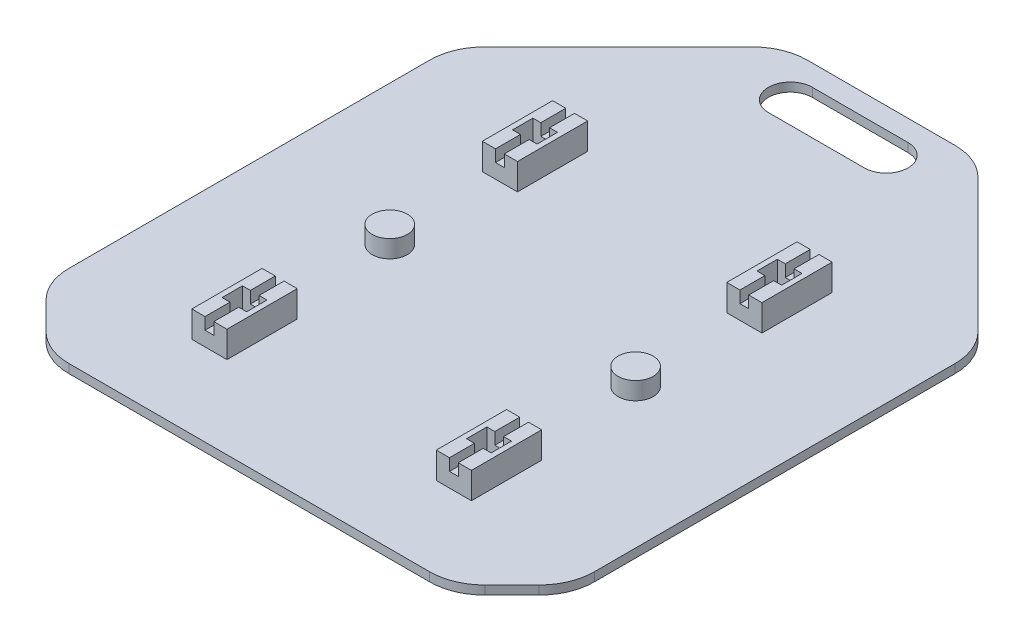
from build123d import *

# Parameters (mm, degrees)
BODY_DEPTH          = 6.35
HANDLE_DEPTH        = 6.35
FILLET1_R           = 40
FILLET2_R           = 40
SKETCH3_W           = 25.4
SKETCH3_H           = 50.8
BOSS_EXTRUDE2_DEPTH = 19.05
SKETCH4_W           = 17.78
SKETCH4_H           = 14.7447
CUT_EXTRUDE1_DEPTH  = 17.78
SKETCH5_W           = 6.35
SKETCH5_H           = 18.02765
CUT_EXTRUDE2_DEPTH  = 8.5725
SKETCH6_R           = 12.7
BOSS_EXTRUDE3_DEPTH = 12.7


with BuildPart() as part:
    # Sketch1 → Body (new body)
    with BuildSketch(Plane(origin=(0, 0, 0), x_dir=(1, 0, 0), z_dir=(0, 1, 0))):
        Polygon((0, 0), (294, 0), (336.996020767, 43.003978862), (336.996020767, 337.003978862), (217, 456.999999629), (77, 456.999999629), (-42.996020767, 337.003978862), (-42.996020767, 43.003978862), align=None)
    extrude(amount=BODY_DEPTH)

    # Sketch2 → Handle (cut)
    with BuildSketch(Plane(origin=(0, 6.35, 0), x_dir=(1, 0, 0), z_dir=(0, 1, 0))):
        with BuildLine():
            Line((112.35, 441.799999629), (181.65, 441.799999629))
            ThreePointArc((181.65, 441.799999629), (197.5, 425.949999629), (181.65, 410.099999629))
            Line((181.65, 410.099999629), (112.35, 410.099999629))
            ThreePointArc((112.35, 410.099999629), (96.5, 425.949999629), (112.35, 441.799999629))
        make_face()
    extrude(amount=-HANDLE_DEPTH, mode=Mode.SUBTRACT)

    # Fillet1
    fillet1_edges = [part.edges().sort_by_distance(p)[0] for p in [
        (77, 3.175, -456.999999629),
        (217, 3.175, -456.999999629),
    ]]
    fillet(fillet1_edges, radius=FILLET1_R)

    # Fillet2
    fillet2_edges = [part.edges().sort_by_distance(p)[0] for p in [
        (-42.996020767, 3.175, -43.003978862),
        (-42.996020767, 3.175, -337.003978862),
        (336.996020767, 3.175, -337.003978862),
        (336.996020767, 3.175, -43.003978862),
        (294, 3.175, 0),
        (0, 3.175, 0),
    ]]
    fillet(fillet2_edges, radius=FILLET2_R)

    # Sketch3 → Boss-Extrude2 (add)
    with BuildSketch(Plane(origin=(0, 6.35, 0), x_dir=(1, 0, 0), z_dir=(0, 1, 0))):
        with Locations((235.396020767, 295.035436367)):
            Rectangle(SKETCH3_W, SKETCH3_H)
        with Locations((58.603979233, 295.035436367)):
            Rectangle(SKETCH3_W, SKETCH3_H)
        with Locations((235.396020767, 84.970353145)):
            Rectangle(SKETCH3_W, SKETCH3_H)
        with Locations((58.603979233, 84.970353145)):
            Rectangle(SKETCH3_W, SKETCH3_H)
    extrude(amount=BOSS_EXTRUDE2_DEPTH)

    # Sketch4 → Cut-Extrude1 (cut)
    with BuildSketch(Plane(origin=(0, 25.4, 0), x_dir=(1, 0, 0), z_dir=(0, 1, 0))):
        with Locations((58.603979233, 295.035436367)):
            Rectangle(SKETCH4_W, SKETCH4_H)
        with Locations((235.396020767, 295.035436367)):
            Rectangle(SKETCH4_W, SKETCH4_H)
        with Locations((58.603979233, 84.970353145)):
            Rectangle(SKETCH4_W, SKETCH4_H)
        with Locations((235.396020767, 84.970353145)):
            Rectangle(SKETCH4_W, SKETCH4_H)
    extrude(amount=-CUT_EXTRUDE1_DEPTH, mode=Mode.SUBTRACT)

    # Sketch5 → Cut-Extrude2 (cut)
    with BuildSketch(Plane(origin=(0, 25.4, 0), x_dir=(1, 0, 0), z_dir=(0, 1, 0))):
        with Locations((58.603979233, 101.356528145)):
            Rectangle(SKETCH5_W, SKETCH5_H)
        with Locations((58.603979233, 311.421611367)):
            Rectangle(SKETCH5_W, SKETCH5_H)
        with Locations((58.603979233, 278.649261367)):
            Rectangle(SKETCH5_W, SKETCH5_H)
        with Locations((235.396020767, 278.649261367)):
            Rectangle(SKETCH5_W, SKETCH5_H)
        with Locations((235.396020767, 311.421611367)):
            Rectangle(SKETCH5_W, SKETCH5_H)
        with Locations((58.603979233, 68.584178145)):
            Rectangle(SKETCH5_W, SKETCH5_H)
        with Locations((235.396020767, 68.584178145)):
            Rectangle(SKETCH5_W, SKETCH5_H)
        with Locations((235.396020767, 101.356528145)):
            Rectangle(SKETCH5_W, SKETCH5_H)
    extrude(amount=-CUT_EXTRUDE2_DEPTH, mode=Mode.SUBTRACT)

    # Sketch6 → Boss-Extrude3 (add)
    with BuildSketch(Plane(origin=(0, 6.35, 0), x_dir=(1, 0, 0), z_dir=(0, 1, 0))):
        with Locations(Location((58.1, 190.5, 0), (0, 0, 90))):
            Circle(SKETCH6_R)
        with Locations(Location((235.9, 190.5, 0), (0, 0, 90))):
            Circle(SKETCH6_R)
    extrude(amount=BOSS_EXTRUDE3_DEPTH)


solid = part.part
